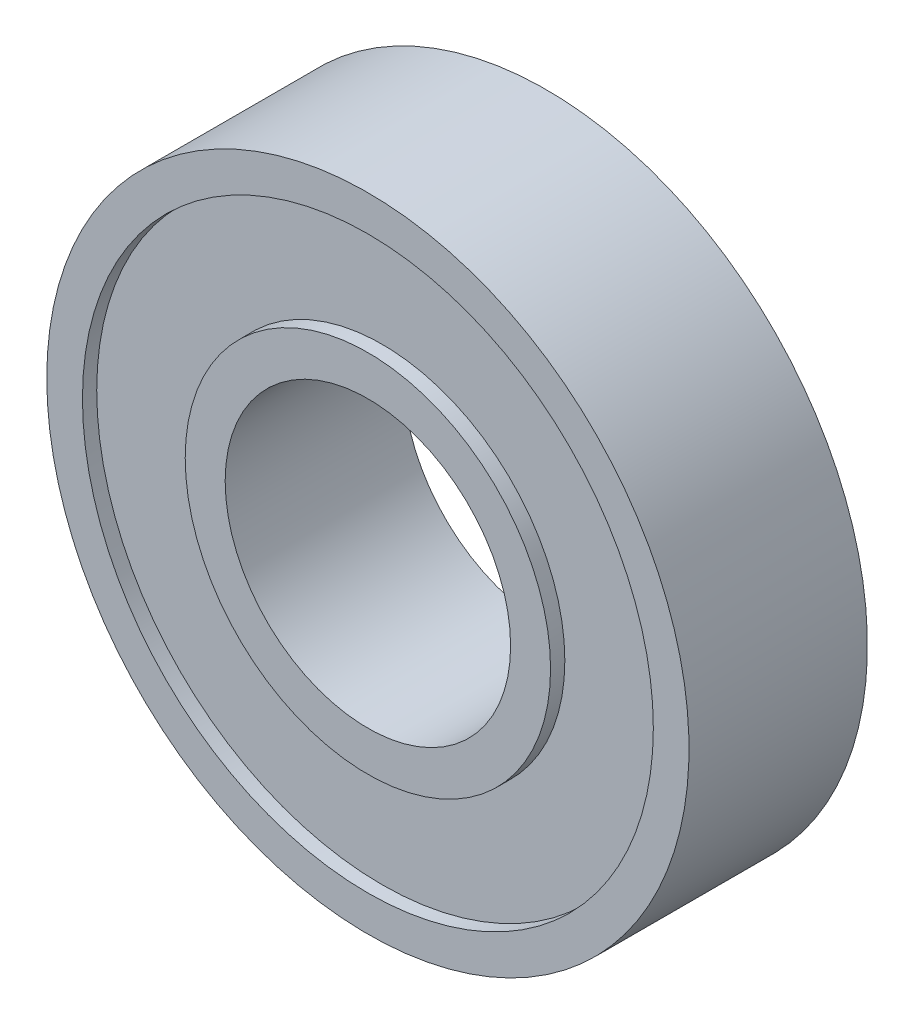
from build123d import *


with BuildPart() as part:
    # Sketch1 → Revolve1 (revolve)
    with BuildSketch(Plane(origin=(0, 0, 0), x_dir=(1, 0, 0), z_dir=(0, 1, 0)), mode=Mode.PRIVATE) as revolve1_sk:
        Polygon((14.2875, -2.38125), (14.2875, -3.96875), (12.7, -3.96875), (12.7, -3.33375), (8.128, -3.33375), (8.128, -3.96875), (6.35, -3.96875), (6.35, 3.96875), (8.128, 3.96875), (8.128, 3.33375), (12.7, 3.33375), (12.7, 3.96875), (14.2875, 3.96875), align=None)
    revolve(revolve1_sk.sketch.rotate(Axis((0, 0, -3.96875), (0, 0, 1)), 180), axis=Axis((0, 0, -3.96875), (0, 0, 1)))


solid = part.part
